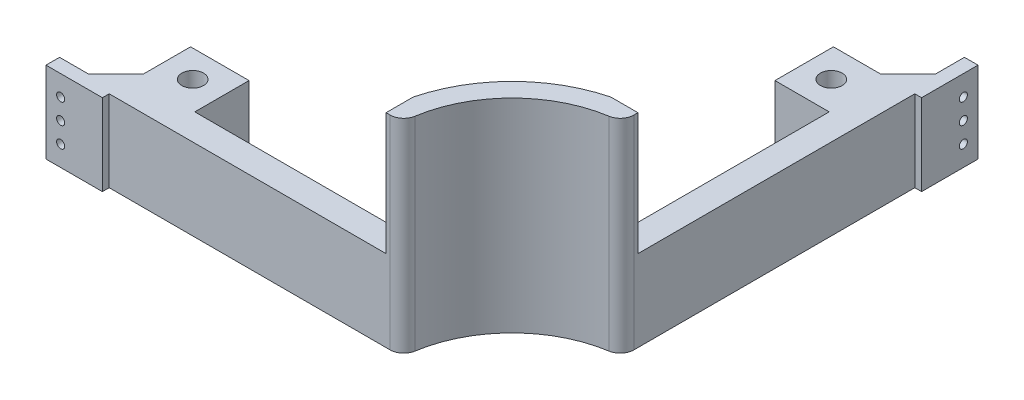
from build123d import *

# Parameters (mm, degrees)
SKETCH2_R           = 4
BOSS_EXTRUDE1_DEPTH = 30
SKETCH10_R          = 1.5
CUT_EXTRUDE1_DEPTH  = 10
SKETCH11_R          = 1.5
CUT_EXTRUDE3_DEPTH  = 10
BOSS_EXTRUDE2_DEPTH = 45


with BuildPart() as part:
    # Sketch2 → Boss-Extrude1 (new body)
    with BuildSketch(Plane(origin=(0, 0, 0), x_dir=(1, 0, 0), z_dir=(0, 1, 0))):
        with BuildLine():
            Line((-2.5, 47.410441888), (-2.5, 49.444413233))
            Line((-2.5, 49.444413233), (-2.5, 151))
            Line((-2.5, 151), (0, 151))
            Line((0, 151), (0, 171.795711314))
            Line((0, 171.795711314), (-5, 171.795711314))
            Line((-5, 171.795711314), (-5, 161))
            Line((-5, 161), (-15, 151))
            Line((-15, 151), (-32.5, 151))
            Line((-32.5, 151), (-32.5, 129.444413233))
            Line((-32.5, 129.444413233), (-12.5, 129.444413233))
            Line((-12.5, 129.444413233), (-12.5, 48.928519291))
            ThreePointArc((-12.5, 48.928519291), (-35.70889245, 35.70889245), (-48.928519291, 12.5))
            Line((-48.928519291, 12.5), (-129.444413233, 12.5))
            Line((-129.444413233, 12.5), (-129.444413233, 32.5))
            Line((-129.444413233, 32.5), (-151, 32.5))
            Line((-151, 32.5), (-151, 15))
            Line((-151, 15), (-161, 5))
            Line((-161, 5), (-171.795711314, 5))
            Line((-171.795711314, 5), (-171.795711314, 0))
            Line((-171.795711314, 0), (-151, 0))
            Line((-151, 0), (-151, 2.5))
            Line((-151, 2.5), (-49.444413233, 2.5))
            Line((-49.444413233, 2.5), (-47.410441888, 2.5))
            ThreePointArc((-47.410441888, 2.5), (-44.162846624, 3.698273419), (-42.471854191, 6.71875))
            ThreePointArc((-42.471854191, 6.71875), (-30.405591591, 30.405591591), (-6.71875, 42.471854191))
            ThreePointArc((-6.71875, 42.471854191), (-3.698273419, 44.162846624), (-2.5, 47.410441888))
        make_face()
        with Locations(Location((-22.5, 140.222206617, 0), (0, 0, 270))):
            Circle(SKETCH2_R, mode=Mode.SUBTRACT)
        with Locations(Location((-140.222206617, 22.5, 0), (0, 0, 270))):
            Circle(SKETCH2_R, mode=Mode.SUBTRACT)
    extrude(amount=BOSS_EXTRUDE1_DEPTH)

    # Sketch10 → Cut-Extrude1 (cut)
    with BuildSketch(Plane.ZY.offset(5)):
        with Locations((-166.397855657, 22.5)):
            Circle(SKETCH10_R)
        with Locations((-166.397855657, 15)):
            Circle(SKETCH10_R)
        with Locations((-166.397855657, 7.5)):
            Circle(SKETCH10_R)
    extrude(amount=-CUT_EXTRUDE1_DEPTH, mode=Mode.SUBTRACT)

    # Sketch11 → Cut-Extrude3 (cut)
    with BuildSketch(Plane(origin=(0, 0, -5), x_dir=(-1, 0, 0), z_dir=(0, 0, -1))):
        with Locations((166.397855657, 22.5)):
            Circle(SKETCH11_R)
        with Locations((166.397855657, 15)):
            Circle(SKETCH11_R)
        with Locations((166.397855657, 7.5)):
            Circle(SKETCH11_R)
    extrude(amount=-CUT_EXTRUDE3_DEPTH, mode=Mode.SUBTRACT)

    # Sketch13 → Boss-Extrude2 (add)
    with BuildSketch(Plane(origin=(0, 30, 0), x_dir=(1, 0, 0), z_dir=(0, 1, 0))):
        with BuildLine():
            Line((-48.928519291, 12.5), (-48.928519291, 2.5))
            Line((-48.928519291, 2.5), (-47.410441888, 2.5))
            ThreePointArc((-47.410441888, 2.5), (-44.162846624, 3.698273419), (-42.471854191, 6.71875))
            ThreePointArc((-42.471854191, 6.71875), (-30.405591591, 30.405591591), (-6.71875, 42.471854191))
            ThreePointArc((-6.71875, 42.471854191), (-3.698273419, 44.162846624), (-2.5, 47.410441888))
            Line((-2.5, 47.410441888), (-2.5, 48.928519291))
            Line((-2.5, 48.928519291), (-12.5, 48.928519291))
            ThreePointArc((-12.5, 48.928519291), (-35.70889245, 35.70889245), (-48.928519291, 12.5))
        make_face()
    extrude(amount=BOSS_EXTRUDE2_DEPTH)


solid = part.part
